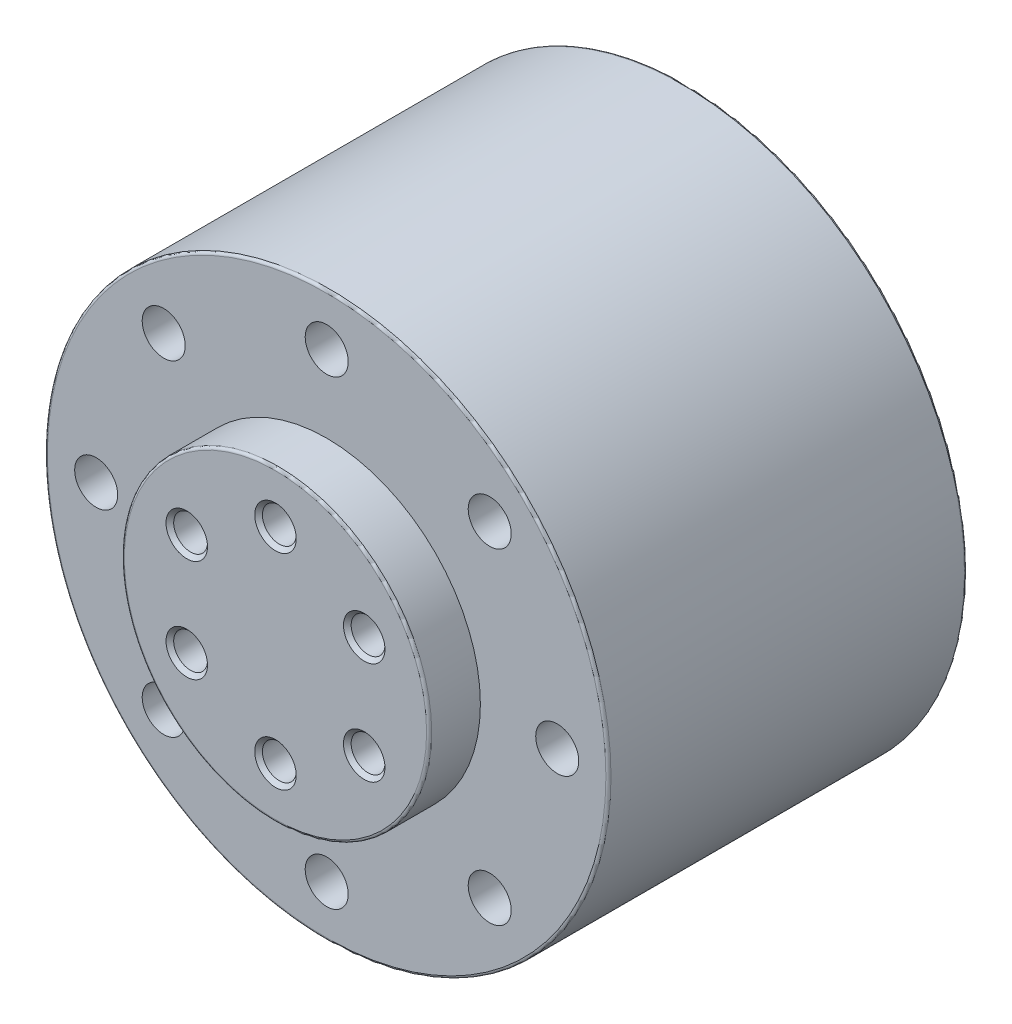
from build123d import *

# Parameters (mm, degrees)
SKETCH_1_R                   = 27.5
EXTRUDE_1_DEPTH              = 35
SKETCH_2_R                   = 15
EXTRUDE_2_DEPTH              = 5
HOLE_WIZARD_M5_1_D           = 4.2
HOLE_WIZARD_M5_1_CSINK_D     = 5.05
HOLE_WIZARD_M5_1_CSINK_ANGLE = 90
HOLE_WIZARD_M4_1_D           = 3.3
HOLE_WIZARD_M4_1_DEPTH       = 10.1
HOLE_WIZARD_M4_1_CSINK_D     = 4.05
HOLE_WIZARD_M4_1_CSINK_ANGLE = 90
HOLE_WIZARD_M4_1_TIP         = 0.991420021
FILLET_1_R                   = 0.25


with BuildPart() as part:
    # 草图1 → 凸台-拉伸1 (new body)
    with BuildSketch(Plane.XY):
        Circle(SKETCH_1_R)
    extrude(amount=EXTRUDE_1_DEPTH)

    # 草图2 → 凸台-拉伸2 (add)
    with BuildSketch(Plane.XY.offset(35)):
        Circle(SKETCH_2_R)
    extrude(amount=EXTRUDE_2_DEPTH)

    # M5 螺纹孔1 (through all)
    with Locations(Plane(origin=(0, 22.5, 0), x_dir=(-1, 0, 0), z_dir=(0, 0, -1))):
        with Locations((0, 0), (15.909902577, -6.590097423), (22.5, -22.5), (15.909902577, -38.409902577), (0, -45), (-15.909902577, -38.409902577), (-22.5, -22.5), (-15.909902577, -6.590097423)):
            CounterSinkHole(HOLE_WIZARD_M5_1_D / 2, HOLE_WIZARD_M5_1_CSINK_D / 2, counter_sink_angle=HOLE_WIZARD_M5_1_CSINK_ANGLE)

    # M4 螺纹孔1
    with Locations(Plane(origin=(0, 10, 40), x_dir=(1, 0, 0), z_dir=(0, 0, 1))):
        with Locations((0, 0), (8.660254038, -5), (8.660254038, -15), (0, -20), (-8.660254038, -15), (-8.660254038, -5)):
            CounterSinkHole(HOLE_WIZARD_M4_1_D / 2, HOLE_WIZARD_M4_1_CSINK_D / 2, depth=HOLE_WIZARD_M4_1_DEPTH, counter_sink_angle=HOLE_WIZARD_M4_1_CSINK_ANGLE)
            with Locations((0, 0, -(HOLE_WIZARD_M4_1_DEPTH + HOLE_WIZARD_M4_1_TIP / 2))):  # 118° drill point
                Cone(0, HOLE_WIZARD_M4_1_D / 2, HOLE_WIZARD_M4_1_TIP, mode=Mode.SUBTRACT)

    # 圆角1
    fillet_1_edges = [part.edges().sort_by_distance(p)[0] for p in [
        (-27.5, 0, 0),
        (-27.5, 0, 35),
        (-15, 0, 40),
    ]]
    fillet(fillet_1_edges, radius=FILLET_1_R)


solid = part.part
